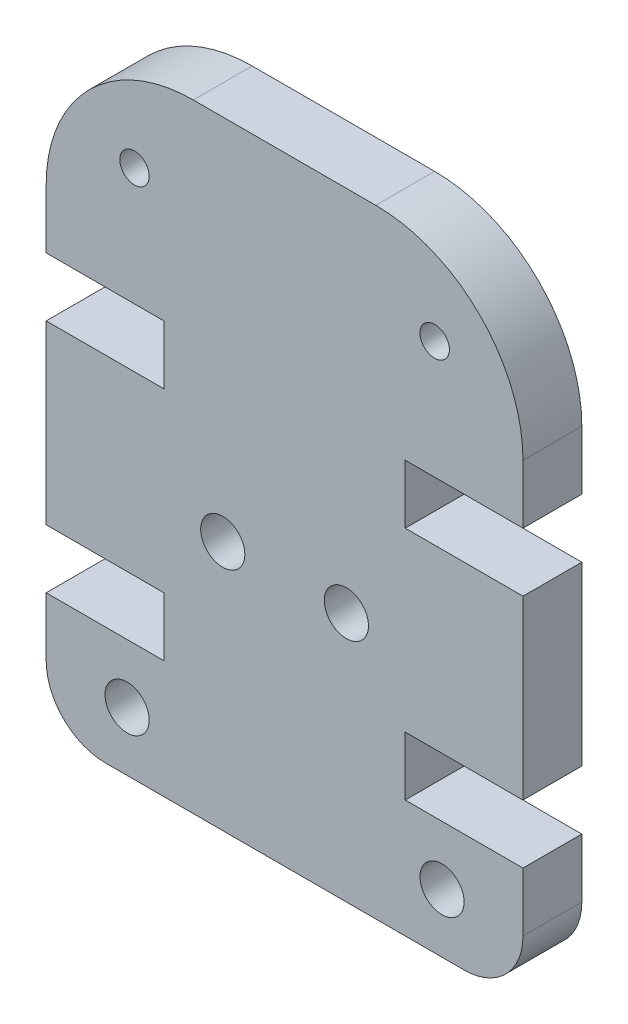
from build123d import *

# Parameters (mm, degrees)
SKETCH1_R           = 0.75
SKETCH1_R_2         = 0.5
BOSS_EXTRUDE1_DEPTH = 2


with BuildPart() as part:
    # Sketch1 → Boss-Extrude1 (new body)
    with BuildSketch(Plane.XY):
        with BuildLine():
            Line((0, 16), (0, 14))
            Line((0, 14), (4, 14))
            Line((4, 14), (4, 12))
            Line((4, 12), (0, 12))
            Line((0, 12), (0, 6))
            Line((0, 6), (4, 6))
            Line((4, 6), (4, 4))
            Line((4, 4), (0, 4))
            Line((0, 4), (0, 2))
            ThreePointArc((0, 2), (0.585786438, 0.585786438), (2, 0))
            Line((2, 0), (14.2, 0))
            ThreePointArc((14.2, 0), (15.614213562, 0.585786438), (16.2, 2))
            Line((16.2, 2), (16.2, 4))
            Line((16.2, 4), (12.2, 4))
            Line((12.2, 4), (12.2, 6))
            Line((12.2, 6), (16.2, 6))
            Line((16.2, 6), (16.2, 12))
            Line((16.2, 12), (12.2, 12))
            Line((12.2, 12), (12.2, 14))
            Line((12.2, 14), (16.2, 14))
            Line((16.2, 14), (16.2, 16))
            ThreePointArc((16.2, 16), (14.735533906, 19.535533906), (11.2, 21))
            Line((11.2, 21), (5, 21))
            ThreePointArc((5, 21), (1.464466094, 19.535533906), (0, 16))
        make_face()
        with Locations((10.2, 8.5)):
            Circle(SKETCH1_R, mode=Mode.SUBTRACT)
        with Locations((6, 8.5)):
            Circle(SKETCH1_R, mode=Mode.SUBTRACT)
        with Locations((3, 18)):
            Circle(SKETCH1_R_2, mode=Mode.SUBTRACT)
        with Locations((13.2, 18)):
            Circle(SKETCH1_R_2, mode=Mode.SUBTRACT)
        with Locations((13.45, 2)):
            Circle(SKETCH1_R, mode=Mode.SUBTRACT)
        with Locations((2.75, 2)):
            Circle(SKETCH1_R, mode=Mode.SUBTRACT)
    extrude(amount=BOSS_EXTRUDE1_DEPTH)


solid = part.part
